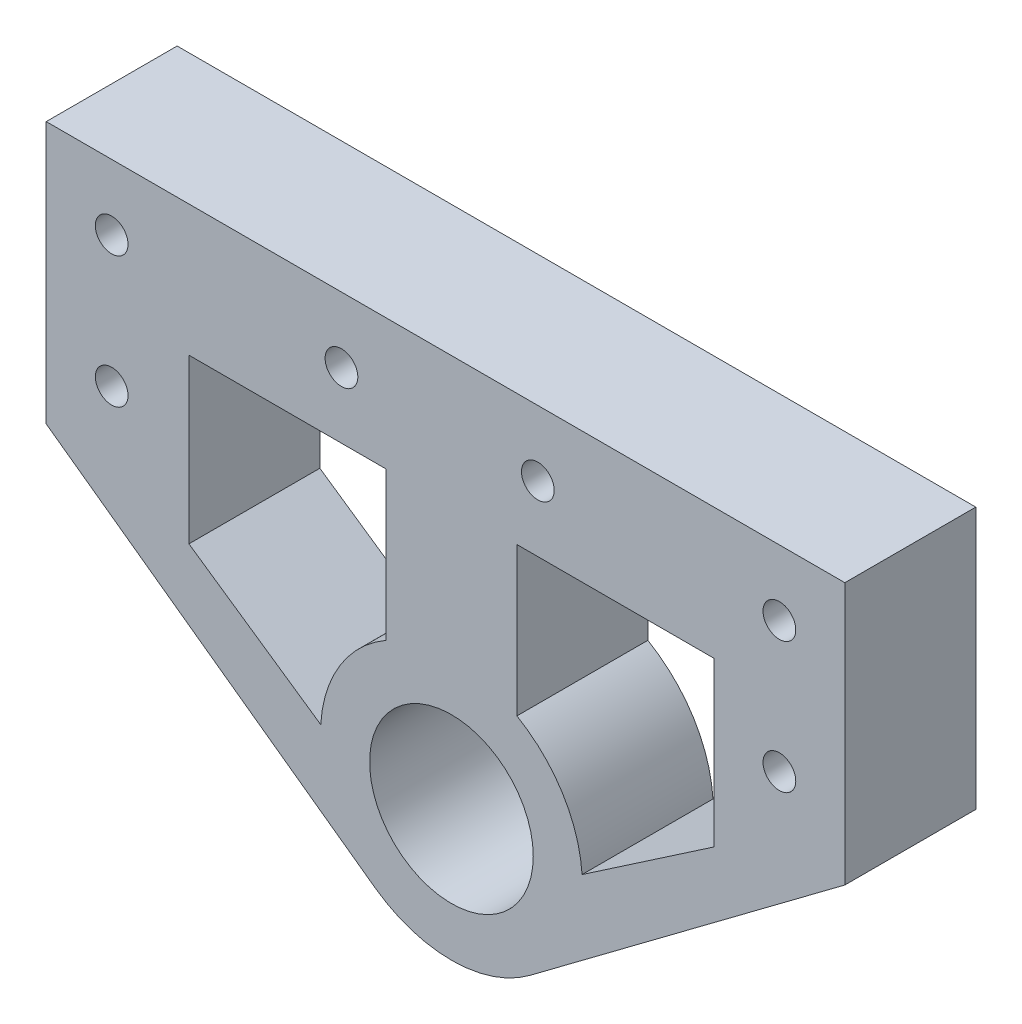
from build123d import *

# Parameters (mm, degrees)
SKETCH1_R           = 7.9375
BOSS_EXTRUDE1_DEPTH = 12.7
SKETCH2_R           = 1.5875
CUT_EXTRUDE1_DEPTH  = 12.7
CUT_EXTRUDE2_DEPTH  = 15.24
FILLET1_R           = 12.7


with BuildPart() as part:
    # Sketch1 → Boss-Extrude1 (new body)
    with BuildSketch(Plane.XY):
        Polygon((41.245841837, 19.276785714), (41.245841837, 44.676785714), (-36.224158163, 44.676785714), (-36.224158163, 19.276785714), (3.2200448, -9.183280125), align=None)
        with Locations((3.082341837, 6.576785714)):
            Circle(SKETCH1_R, mode=Mode.SUBTRACT)
    extrude(amount=BOSS_EXTRUDE1_DEPTH)

    # Sketch2 → Cut-Extrude1 (cut)
    with BuildSketch(Plane.XY.offset(12.7)):
        with Locations((-29.874158163, 38.326785714)):
            Circle(SKETCH2_R)
        with Locations((-29.874158163, 25.626785714)):
            Circle(SKETCH2_R)
        with Locations((34.895841837, 38.326785714)):
            Circle(SKETCH2_R)
        with Locations((34.895841837, 25.626785714)):
            Circle(SKETCH2_R)
        with Locations((-7.585658163, 38.326785714)):
            Circle(SKETCH2_R)
        with Locations((11.464341837, 38.326785714)):
            Circle(SKETCH2_R)
    extrude(amount=-CUT_EXTRUDE1_DEPTH, mode=Mode.SUBTRACT)

    # Sketch3 → Cut-Extrude2 (cut)
    with BuildSketch(Plane.XY.offset(12.7)):
        with BuildLine():
            Line((-22.381158163, 31.976785714), (-3.267658163, 31.976785714))
            Line((-3.267658163, 31.976785714), (-3.267658163, 17.575308342))
            ThreePointArc((-3.267658163, 17.575308342), (-7.722098193, 13.251669657), (-9.595109212, 7.333247809))
            Line((-9.595109212, 7.333247809), (-22.381158163, 16.12545158))
            Line((-22.381158163, 16.12545158), (-22.381158163, 31.976785714))
        make_face()
        with BuildLine():
            Line((9.432341837, 17.575308342), (9.432341837, 31.976785714))
            Line((9.432341837, 31.976785714), (28.545841837, 31.976785714))
            Line((28.545841837, 31.976785714), (28.545841837, 16.12545158))
            Line((28.545841837, 16.12545158), (15.754893995, 7.41130462))
            ThreePointArc((15.754893995, 7.41130462), (13.866177683, 13.284906497), (9.432341837, 17.575308342))
        make_face()
    extrude(amount=-CUT_EXTRUDE2_DEPTH, mode=Mode.SUBTRACT)

    # Fillet1
    fillet1_edges = [part.edges().sort_by_distance(p)[0] for p in [
        (3.2200448, -9.183280125, 6.35),
    ]]
    fillet(fillet1_edges, radius=FILLET1_R)


solid = part.part
